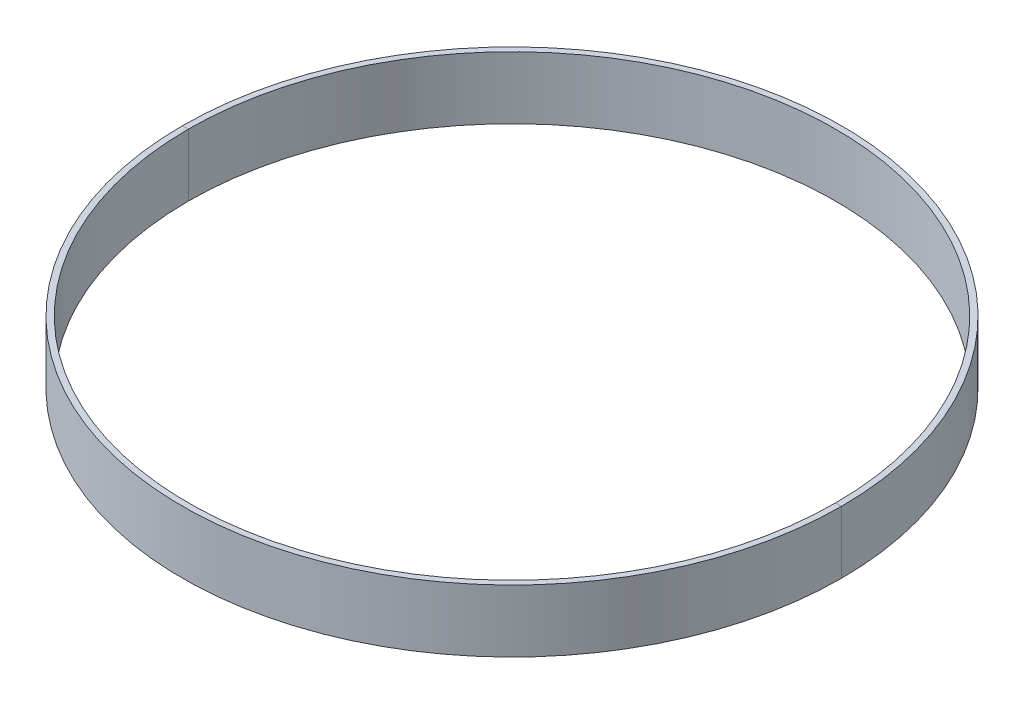
from build123d import *

# Parameters (mm, degrees)
BOSS_EXTRUDE1_DEPTH = 13.25


with BuildPart() as part:
    # Sketch2 → Boss-Extrude1 (new, symmetric)
    with BuildSketch(Plane(origin=(0, 0, 0), x_dir=(1, 0, 0), z_dir=(0, 1, 0))):
        with BuildLine():
            ThreePointArc((53.57568053111268, 129.34313455158008), (8.57e-15, 139.99999999999997), (-53.57568053111271, 129.3431345515801))
            ThreePointArc((-53.57568053111271, 129.3431345515801), (-98.99494936611619, 98.99494936611717), (-129.34313455157954, 53.57568053111404))
            ThreePointArc((-129.34313455157954, 53.57568053111404), (-140, 1.50928e-12), (-129.3431345515807, -53.57568053111133))
            ThreePointArc((-129.3431345515807, -53.57568053111133), (-98.99494936611755, -98.9949493661158), (-53.57568053111358, -129.34313455157968))
            ThreePointArc((-53.57568053111358, -129.34313455157968), (-9.8619e-13, -139.99999999999997), (53.57568053111179, -129.34313455158048))
            ThreePointArc((53.57568053111179, -129.34313455158048), (98.99494936611613, -98.99494936611717), (129.34313455157988, -53.57568053111315))
            ThreePointArc((129.34313455157988, -53.57568053111315), (139.99999999999997, -5.0515e-13), (129.3431345515803, 53.57568053111223))
            ThreePointArc((129.3431345515803, 53.57568053111223), (98.99494936611686, 98.9949493661165), (53.57568053111268, 129.34313455158008))
        make_face()
        with BuildLine():
            ThreePointArc((52.61897195019996, 127.0334357203019), (8.42e-15, 137.50000000000003), (-52.618971950199956, 127.0334357203019))
            ThreePointArc((-52.618971950199956, 127.0334357203019), (-97.22718241314976, 97.22718241315081), (-127.03343572030134, 52.61897195020129))
            ThreePointArc((-127.03343572030134, 52.61897195020129), (-137.5, 1.48233e-12), (-127.0334357203025, -52.61897195019865))
            ThreePointArc((-127.0334357203025, -52.61897195019865), (-97.22718241315121, -97.22718241314949), (-52.61897195020085, -127.03343572030148))
            ThreePointArc((-52.61897195020085, -127.03343572030148), (-9.6858e-13, -137.49999999999997), (52.6189719501991, -127.03343572030226))
            ThreePointArc((52.6189719501991, -127.03343572030226), (97.2271824131498, -97.22718241315081), (127.03343572030171, -52.61897195020042))
            ThreePointArc((127.03343572030171, -52.61897195020042), (137.50000000000003, -4.885e-13), (127.03343572030212, 52.61897195019953))
            ThreePointArc((127.03343572030212, 52.61897195019953), (97.2271824131505, 97.22718241315015), (52.61897195019996, 127.0334357203019))
        make_face(mode=Mode.SUBTRACT)
    extrude(amount=BOSS_EXTRUDE1_DEPTH, both=True)


with BuildPart() as body_2:
    # Split1: the piece on the far side of the plane
    add(part.part)
    split(bisect_by=Plane.XY, keep=Keep.BOTTOM)


with BuildPart() as part_1:
    add(part.part)

    # Split1
    split(bisect_by=Plane.XY, keep=Keep.TOP)


solid = Compound([body_2.part, part_1.part])
